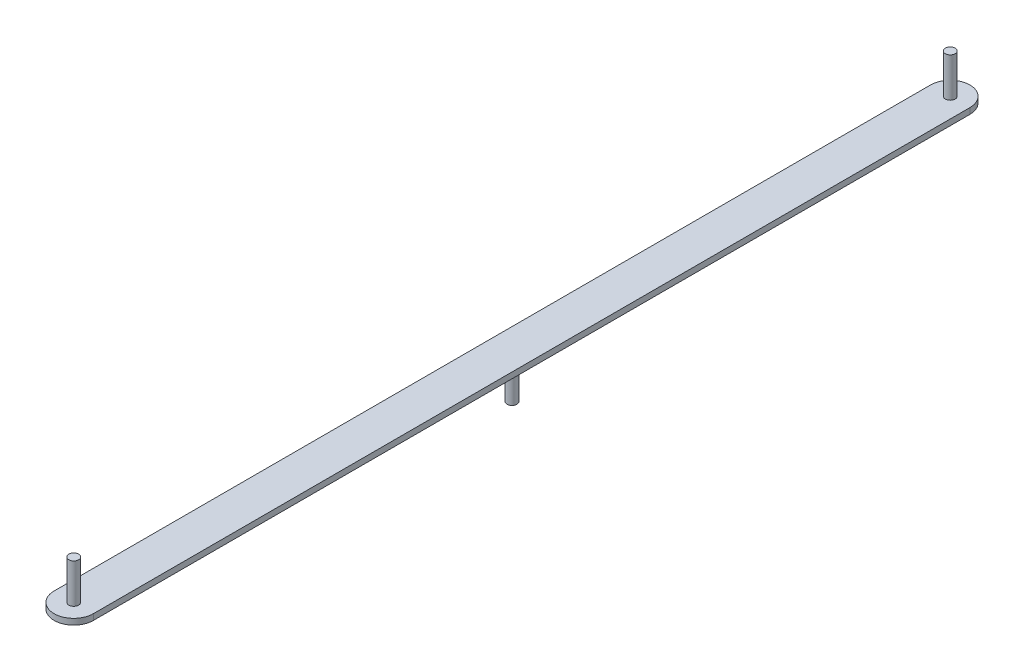
from build123d import *

# Parameters (mm, degrees)
BOSS_EXTRUDE1_DEPTH = 3
SKETCH2_R           = 2.5
BOSS_EXTRUDE2_DEPTH = 20
SKETCH3_R           = 5
BOSS_EXTRUDE3_DEPTH = 2
SKETCH4_R           = 2.5
BOSS_EXTRUDE4_DEPTH = 18


with BuildPart() as part:
    # Sketch1 → Boss-Extrude1 (new body)
    with BuildSketch(Plane(origin=(0, 0, 0), x_dir=(1, 0, 0), z_dir=(0, 1, 0))):
        with BuildLine():
            Line((-25.769230769, 365.615384615), (-25.769230769, -80.384615385))
            ThreePointArc((-25.769230769, -80.384615385), (-15.769230769, -90.384615385), (-5.769230769, -80.384615385))
            Line((-5.769230769, -80.384615385), (-5.769230769, 365.615384615))
            ThreePointArc((-5.769230769, 365.615384615), (-15.769230769, 375.615384615), (-25.769230769, 365.615384615))
        make_face()
    extrude(amount=BOSS_EXTRUDE1_DEPTH)

    # Sketch2 → Boss-Extrude2 (add)
    with BuildSketch(Plane(origin=(0, 3, 0), x_dir=(1, 0, 0), z_dir=(0, 1, 0))):
        with Locations(Location((-15.769230769, -80.384615385, 0), (0, 0, 90))):
            Circle(SKETCH2_R)
        with Locations(Location((-15.769230769, 365.615384615, 0), (0, 0, 90))):
            Circle(SKETCH2_R)
    extrude(amount=BOSS_EXTRUDE2_DEPTH)

    # Sketch3 → Boss-Extrude3 (add)
    with BuildSketch(Plane.XZ):
        with Locations(Location((-15.769230769, -142.615384615, 0), (0, 0, 270))):
            Circle(SKETCH3_R)
    extrude(amount=BOSS_EXTRUDE3_DEPTH)

    # Sketch4 → Boss-Extrude4 (add)
    with BuildSketch(Plane.XZ.offset(2)):
        with Locations(Location((-15.769230769, -142.615384615, 0), (0, 0, 270))):
            Circle(SKETCH4_R)
    extrude(amount=BOSS_EXTRUDE4_DEPTH)


solid = part.part
